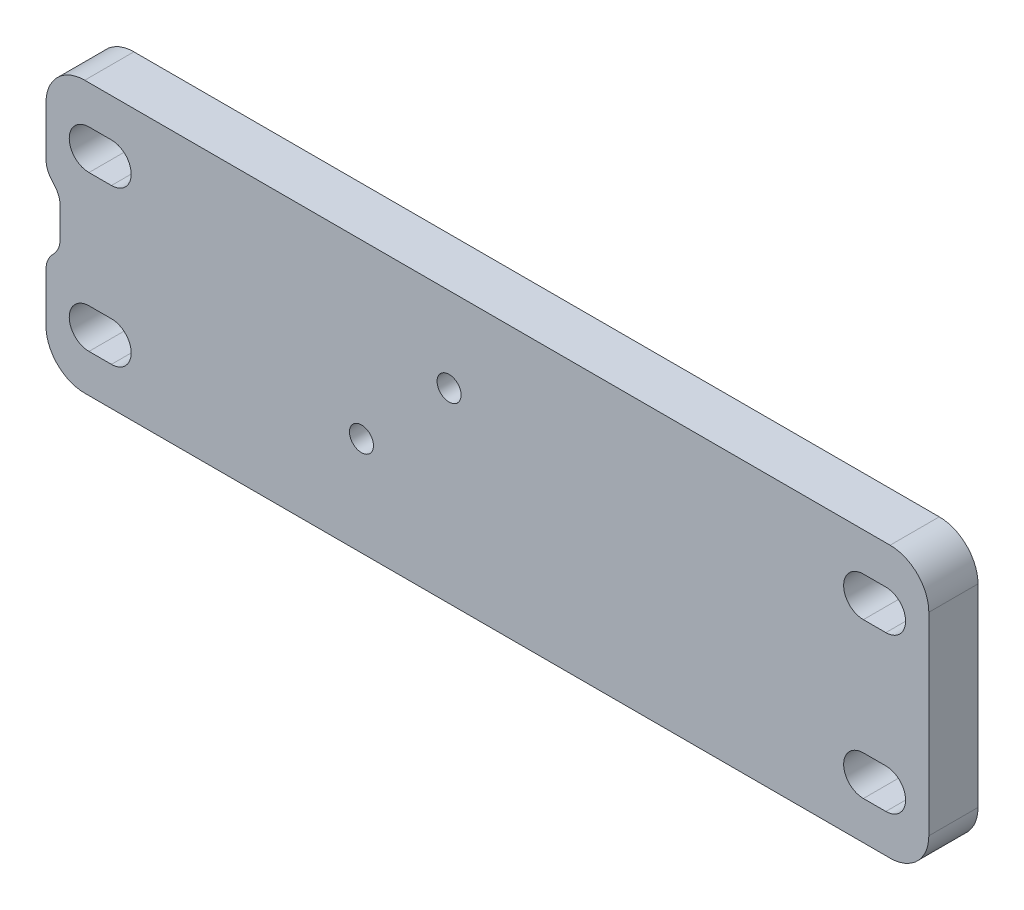
from build123d import *

# Parameters (mm, degrees)
SKETCH1_R           = 1.549999999
BOSS_EXTRUDE1_DEPTH = 6.35


with BuildPart() as part:
    # Sketch1 → Boss-Extrude1 (new body)
    with BuildSketch(Plane.XY):
        with BuildLine():
            Line((231.100613802, 220.383854223), (231.100613802, 226.717998483))
            ThreePointArc((231.100613802, 226.717998483), (231.304344536, 227.804680676), (231.887865928, 228.743769162))
            Line((231.887865928, 228.743769162), (232.144361676, 229.023939287))
            ThreePointArc((232.144361676, 229.023939287), (232.727883068, 229.963027773), (232.931613801, 231.049709965))
            Line((232.931613801, 231.049709965), (232.931613801, 234.717998484))
            ThreePointArc((232.931613801, 234.717998484), (232.727883068, 235.804680676), (232.144361676, 236.743769162))
            Line((232.144361676, 236.743769162), (231.887865928, 237.023939287))
            ThreePointArc((231.887865928, 237.023939287), (231.304344536, 237.963027773), (231.100613802, 239.049709966))
            Line((231.100613802, 239.049709966), (231.100613802, 245.383854224))
            ThreePointArc((231.100613802, 245.383854224), (232.565079896, 248.91938813), (236.100613802, 250.383854224))
            Line((236.100613802, 250.383854224), (340.100613803, 250.383854224))
            ThreePointArc((340.100613803, 250.383854224), (343.636147709, 248.919388129), (345.100613803, 245.383854222))
            Line((345.100613803, 245.383854222), (345.100613803, 220.383854223))
            ThreePointArc((345.100613803, 220.383854223), (343.636147709, 216.848320317), (340.100613803, 215.383854223))
            Line((340.100613803, 215.383854223), (236.100613802, 215.383854223))
            ThreePointArc((236.100613802, 215.383854223), (232.565079896, 216.848320317), (231.100613802, 220.383854223))
        make_face()
        with Locations((271.837613804, 228.153854225)):
            Circle(SKETCH1_R, mode=Mode.SUBTRACT)
        with Locations((283.150613802, 239.467854223)):
            Circle(SKETCH1_R, mode=Mode.SUBTRACT)
        with BuildLine():
            Line((339.550613803, 220.333854223), (336.650613802, 220.333854223))
            ThreePointArc((336.650613802, 220.333854223), (334.100613802, 222.883854224), (336.650613802, 225.433854224))
            Line((336.650613802, 225.433854224), (339.550613803, 225.433854224))
            ThreePointArc((339.550613803, 225.433854224), (342.100613803, 222.883854224), (339.550613803, 220.333854223))
        make_face(mode=Mode.SUBTRACT)
        with BuildLine():
            Line((236.650613802, 220.333854223), (239.550613804, 220.333854223))
            ThreePointArc((239.550613804, 220.333854223), (242.100613804, 222.883854224), (239.550613804, 225.433854224))
            Line((239.550613804, 225.433854224), (236.650613802, 225.433854224))
            ThreePointArc((236.650613802, 225.433854224), (234.100613802, 222.883854224), (236.650613802, 220.333854223))
        make_face(mode=Mode.SUBTRACT)
        with BuildLine():
            Line((239.550613804, 240.333854223), (236.650613802, 240.333854223))
            ThreePointArc((236.650613802, 240.333854223), (234.100613802, 242.883854224), (236.650613802, 245.433854224))
            Line((236.650613802, 245.433854224), (239.550613804, 245.433854224))
            ThreePointArc((239.550613804, 245.433854224), (242.100613804, 242.883854224), (239.550613804, 240.333854223))
        make_face(mode=Mode.SUBTRACT)
        with BuildLine():
            Line((336.650613802, 240.333854223), (339.550613803, 240.333854223))
            ThreePointArc((339.550613803, 240.333854223), (342.100613803, 242.883854224), (339.550613803, 245.433854224))
            Line((339.550613803, 245.433854224), (336.650613802, 245.433854224))
            ThreePointArc((336.650613802, 245.433854224), (334.100613802, 242.883854224), (336.650613802, 240.333854223))
        make_face(mode=Mode.SUBTRACT)
    extrude(amount=BOSS_EXTRUDE1_DEPTH)


solid = part.part
